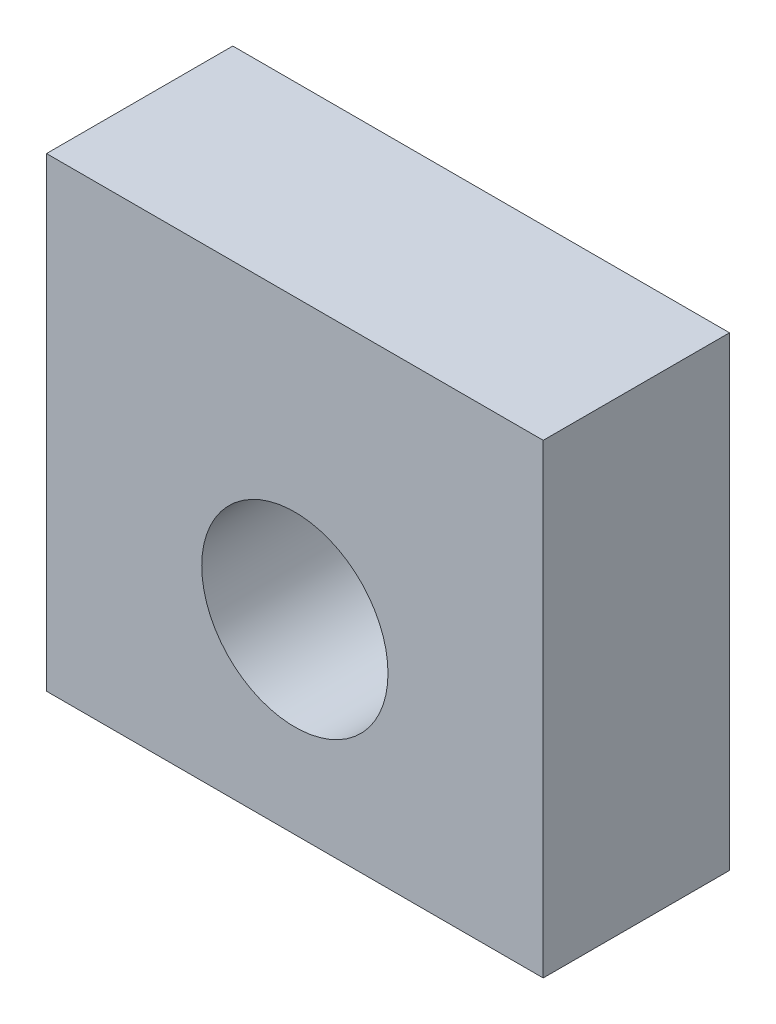
from build123d import *

# Parameters (mm, degrees)
ESBO_O1_W                = 8
ESBO_O1_H                = 7.5
ESBO_O1_R                = 1.5
RESSALTO_EXTRUS_O1_DEPTH = 3


with BuildPart() as part:
    # Esboço1 → Ressalto-extrusão1 (new body)
    with BuildSketch(Plane.XY):
        Rectangle(ESBO_O1_W, ESBO_O1_H)
        with Locations((0, -0.75)):
            Circle(ESBO_O1_R, mode=Mode.SUBTRACT)
    extrude(amount=RESSALTO_EXTRUS_O1_DEPTH)


solid = part.part
